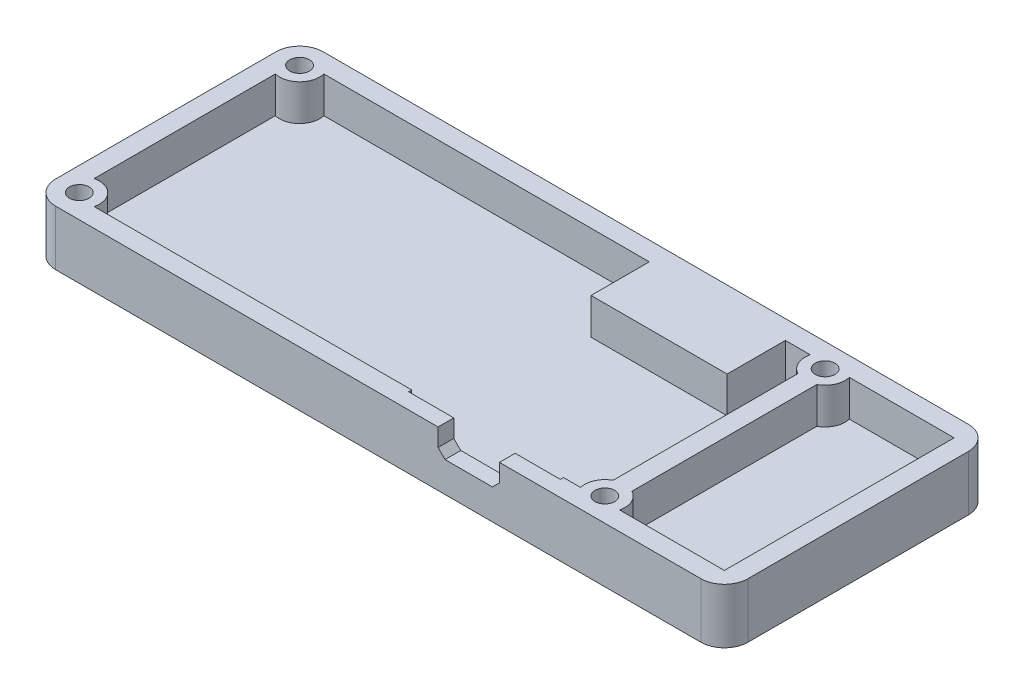
from build123d import *

# Parameters (mm, degrees)
SKETCH1_W           = 71
SKETCH1_H           = 34
BOSS_EXTRUDE1_DEPTH = 7
SHELL1_T            = -2.4
SKETCH3_W           = 17
SKETCH3_H           = 34
BOSS_EXTRUDE2_DEPTH = 7
SKETCH4_W           = 14.6
SKETCH4_H           = 29.2
CUT_EXTRUDE2_DEPTH  = 4.6
SKETCH5_W           = 19.3
SKETCH5_H           = 0.4
CUT_EXTRUDE3_DEPTH  = 4.6
CUT_EXTRUDE4_DEPTH  = 2
SKETCH7_W           = 17.3
SKETCH7_H           = 7.4
BOSS_EXTRUDE3_DEPTH = 4.6
FILLET1_R           = 3
SKETCH8_R           = 2.5546875
BOSS_EXTRUDE4_DEPTH = 7
CUT_EXTRUDE5_REACH  = 57.626
SKETCH9_R           = 1.25
SKETCH10_R          = 2.15
CUT_EXTRUDE6_DEPTH  = 1.6


with BuildPart() as part:
    # Sketch1 → Boss-Extrude1 (new body)
    with BuildSketch(Plane(origin=(0, 0, 0), x_dir=(1, 0, 0), z_dir=(0, 1, 0))):
        Rectangle(SKETCH1_W, SKETCH1_H)
    extrude(amount=BOSS_EXTRUDE1_DEPTH)

    # Shell1
    shell1_openings = [part.faces().sort_by_distance(p)[0] for p in [
        (0, 7, 0),
    ]]
    offset(amount=SHELL1_T, openings=shell1_openings, kind=Kind.INTERSECTION)

    # Sketch3 → Boss-Extrude2 (add)
    with BuildSketch(Plane.XZ):
        with Locations((44, 0)):
            Rectangle(SKETCH3_W, SKETCH3_H)
    extrude(amount=-BOSS_EXTRUDE2_DEPTH)

    # Sketch4 → Cut-Extrude2 (cut)
    with BuildSketch(Plane(origin=(0, 7, 0), x_dir=(1, 0, 0), z_dir=(0, 1, 0))):
        with Locations((42.8, 0)):
            Rectangle(SKETCH4_W, SKETCH4_H)
    extrude(amount=-CUT_EXTRUDE2_DEPTH, mode=Mode.SUBTRACT)

    # Sketch5 → Cut-Extrude3 (cut)
    with BuildSketch(Plane(origin=(0, 7, 0), x_dir=(1, 0, 0), z_dir=(0, 1, 0))):
        with Locations((20, -14.8)):
            Rectangle(SKETCH5_W, SKETCH5_H)
    extrude(amount=-CUT_EXTRUDE3_DEPTH, mode=Mode.SUBTRACT)

    # Sketch6 → Cut-Extrude4 (cut)
    with BuildSketch(Plane.XY.offset(17)):
        Polygon((16.1, 4.737867966), (16.987867966, 3.85), (23.012132034, 3.85), (23.9, 4.737867966), (23.9, 6.3), (23.9, 7), (16.1, 7), (16.1, 6.3), align=None)
    extrude(amount=-CUT_EXTRUDE4_DEPTH, mode=Mode.SUBTRACT)

    # Sketch7 → Boss-Extrude3 (add)
    with BuildSketch(Plane(origin=(0, 2.4, 0), x_dir=(1, 0, 0), z_dir=(0, 1, 0))):
        with Locations((20, 10.9)):
            Rectangle(SKETCH7_W, SKETCH7_H)
    extrude(amount=BOSS_EXTRUDE3_DEPTH)

    # Fillet1
    fillet1_edges = [part.edges().sort_by_distance(p)[0] for p in [
        (52.5, 3.5, -17),
        (52.5, 3.5, 17),
        (-35.5, 3.5, 17),
        (-35.5, 3.5, -17),
    ]]
    fillet(fillet1_edges, radius=FILLET1_R)

    # Sketch8 → Boss-Extrude4 (add)
    with BuildSketch(Plane(origin=(0, 0, 0), x_dir=(-1, 0, 0), z_dir=(0, -1, 0))):
        with Locations((32.5, 14)):
            Circle(SKETCH8_R)
        with Locations((32.5, -14)):
            Circle(SKETCH8_R)
        with Locations((-34.3, 14)):
            Circle(SKETCH8_R)
        with Locations((-34.3, -14)):
            Circle(SKETCH8_R)
    extrude(amount=-BOSS_EXTRUDE4_DEPTH)

    # Sketch9 → Cut-Extrude5 (cut, up to next)
    with BuildSketch(Plane.XZ, mode=Mode.PRIVATE) as cut_extrude5_sk1:
        with Locations(Location((-32.5, -14, 0), (0, 0, 270))):
            Circle(SKETCH9_R)
    cut_extrude5_tool1 = extrude(cut_extrude5_sk1.sketch, amount=-CUT_EXTRUDE5_REACH, mode=Mode.PRIVATE) & part.part
    # Sketch9 → Cut-Extrude5 (cut, up to next)
    with BuildSketch(Plane.XZ, mode=Mode.PRIVATE) as cut_extrude5_sk2:
        with Locations(Location((-32.5, 14, 0), (0, 0, 270))):
            Circle(SKETCH9_R)
    cut_extrude5_tool2 = extrude(cut_extrude5_sk2.sketch, amount=-CUT_EXTRUDE5_REACH, mode=Mode.PRIVATE) & part.part
    # Sketch9 → Cut-Extrude5 (cut, up to next)
    with BuildSketch(Plane.XZ, mode=Mode.PRIVATE) as cut_extrude5_sk3:
        with Locations(Location((34.3, -14, 0), (0, 0, 270))):
            Circle(SKETCH9_R)
    cut_extrude5_tool3 = extrude(cut_extrude5_sk3.sketch, amount=-CUT_EXTRUDE5_REACH, mode=Mode.PRIVATE) & part.part
    # Sketch9 → Cut-Extrude5 (cut, up to next)
    with BuildSketch(Plane.XZ, mode=Mode.PRIVATE) as cut_extrude5_sk4:
        with Locations(Location((34.3, 14, 0), (0, 0, 270))):
            Circle(SKETCH9_R)
    cut_extrude5_tool4 = extrude(cut_extrude5_sk4.sketch, amount=-CUT_EXTRUDE5_REACH, mode=Mode.PRIVATE) & part.part
    add(cut_extrude5_tool1.solids().sort_by_distance((-32.5, 0, -14))[0], mode=Mode.SUBTRACT)
    add(cut_extrude5_tool2.solids().sort_by_distance((-32.5, 0, 14))[0], mode=Mode.SUBTRACT)
    add(cut_extrude5_tool3.solids().sort_by_distance((34.3, 0, -14))[0], mode=Mode.SUBTRACT)
    add(cut_extrude5_tool4.solids().sort_by_distance((34.3, 0, 14))[0], mode=Mode.SUBTRACT)

    # Sketch10 → Cut-Extrude6 (cut)
    with BuildSketch(Plane.XZ):
        with Locations(Location((34.3, 14, 0), (0, 0, 270))):
            Circle(SKETCH10_R)
        with Locations(Location((-32.5, -14, 0), (0, 0, 270))):
            Circle(SKETCH10_R)
        with Locations(Location((-32.5, 14, 0), (0, 0, 270))):
            Circle(SKETCH10_R)
        with Locations(Location((34.3, -14, 0), (0, 0, 270))):
            Circle(SKETCH10_R)
    extrude(amount=-CUT_EXTRUDE6_DEPTH, mode=Mode.SUBTRACT)


solid = part.part
